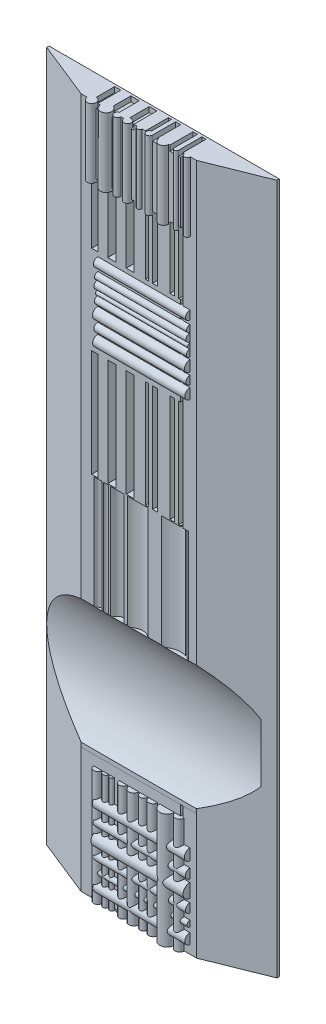
from build123d import *

# Parameters (mm, degrees)
SKETCH_1_W               = 10
SKETCH_1_H               = 30
EXTRUDE_1_DEPTH          = 0.1
EXTRUDE_3_DEPTH          = 30
SKETCH_5_W               = 0.454498822
SKETCH_5_H               = 30
SKETCH_5_W_2             = 0.583425646
SKETCH_5_W_3             = 0.53289148
SKETCH_5_W_4             = 0.499585763
SKETCH_5_W_5             = 0.432974328
SKETCH_5_W_6             = 0.188690598
EXTRUDE_4_DEPTH          = 1
SKETCH_6_W               = 0.173436604
SKETCH_6_H               = 29.993160216
EXTRUDE_5_DEPTH          = 1
SKETCH_8_W               = 3.86453934
SKETCH_8_H               = 5.343305872
SKETCH_8_H_2             = 5.042727614
SKETCH_8_H_3             = 3.852105428
SKETCH_8_H_4             = 2.649348074
EXTRUDE_6_DEPTH          = 1.1
SKETCH_9_R               = 0.240637295
SKETCH_9_R_2             = 0.202893243
SKETCH_9_R_3             = 0.297886253
SKETCH_9_R_4             = 0.192533604
SKETCH_9_R_5             = 0.130246979
SKETCH_9_R_6             = 0.222566816
SKETCH_9_R_7             = 0.191849261
SKETCH_9_R_8             = 0.146339903
SKETCH_9_R_9             = 0.170889957
SKETCH_9_R_10            = 0.154967887
SKETCH_9_R_11            = 0.099932002
SKETCH_9_R_12            = 0.234549929
SKETCH_9_R_13            = 0.176452329
SKETCH_9_R_14            = 0.225025609
EXTRUDE_7_DEPTH          = 4
SKETCH_10_R              = 0.177116069
EXTRUDE_10_DEPTH         = 5
SKETCH_10_R_2            = 0.129224803
EXTRUDE_10_2_DEPTH       = 5
SKETCH_10_R_3            = 0.10088007
EXTRUDE_10_3_DEPTH       = 5
SKETCH_10_R_4            = 0.176516126
EXTRUDE_10_4_DEPTH       = 5
SKETCH_10_R_5            = 0.21589061
EXTRUDE_10_5_DEPTH       = 5
SKETCH_10_R_6            = 0.174927125
EXTRUDE_10_6_DEPTH       = 5
SKETCH_10_R_7            = 0.193106243
EXTRUDE_10_7_DEPTH       = 5
SKETCH_10_R_8            = 0.316233655
EXTRUDE_10_8_DEPTH       = 5
SKETCH_10_R_9            = 0.197180527
EXTRUDE_10_9_DEPTH       = 5
SKETCH_11_R              = 0.196390845
SKETCH_11_R_2            = 0.245040541
SKETCH_11_R_3            = 0.145285858
SKETCH_11_R_4            = 0.158750232
SKETCH_11_R_5            = 0.105230331
SKETCH_11_R_6            = 0.136978563
SKETCH_11_R_7            = 0.21493991
SKETCH_11_R_8            = 0.094345299
SKETCH_11_R_9            = 0.130190265
EXTRUDE_11_DEPTH         = 3
SKETCH_12_R              = 0.177116069
SKETCH_12_R_2            = 0.102016514
SKETCH_12_R_3            = 0.289040351
SKETCH_12_R_4            = 0.571176078
SKETCH_12_R_5            = 0.818961001
CUT_EXTRUDE_1_DEPTH      = 5
SKETCH_13_W              = 4.974552889
SKETCH_13_H              = 1.100632881
EXTRUDE_12_DEPTH         = 5.5
CUT_EXTRUDE_2_DEPTH      = 9.5
CUT_EXTRUDE_2_DEPTH_BACK = 1
SKETCH_14_R              = 4.139688501


with BuildPart() as part:
    # 草图1 → 凸台-拉伸1 (new body)
    with BuildSketch(Plane.XY):
        with Locations((5, 15)):
            Rectangle(SKETCH_1_W, SKETCH_1_H)
    extrude(amount=EXTRUDE_1_DEPTH)

    # 草图4 → 凸台-拉伸3 (add)
    with BuildSketch(Plane.XZ):
        Polygon((0, 0.1), (2.499347574, 0.1), (2.499347574, 1.100632881), align=None)
        Polygon((10, 0.1), (7.500652426, 0.1), (7.500652426, 1.100632881), align=None)
    extrude(amount=-EXTRUDE_3_DEPTH)

    # 草图5 → 凸台-拉伸4 (add)
    with BuildSketch(Plane.XY.offset(0.1)):
        with Locations((2.726596985, 15)):
            Rectangle(SKETCH_5_W, SKETCH_5_H)
        with Locations((7.208939603, 15)):
            Rectangle(SKETCH_5_W_2, SKETCH_5_H)
        with Locations((6.084583842, 15)):
            Rectangle(SKETCH_5_W_3, SKETCH_5_H)
        with Locations((5.035453741, 15)):
            Rectangle(SKETCH_5_W_4, SKETCH_5_H)
        with Locations((4.23611652, 15)):
            Rectangle(SKETCH_5_W_5, SKETCH_5_H)
        with Locations((3.4367793, 15)):
            Rectangle(SKETCH_5_W_5, SKETCH_5_H)
        with Locations((6.639188729, 15)):
            Rectangle(SKETCH_5_W_6, SKETCH_5_H)
    extrude(amount=EXTRUDE_4_DEPTH)

    # 草图6 → 凸台-拉伸5 (add)
    with BuildSketch(Plane.XY.offset(0.1)):
        with Locations((5.509334574, 15.003419892)):
            Rectangle(SKETCH_6_W, SKETCH_6_H)
    extrude(amount=EXTRUDE_5_DEPTH)

    # 草图8 → 凸台-拉伸6 (add)
    with BuildSketch(Plane(origin=(0, 0, 0), x_dir=(-1, 0, 0), z_dir=(0, 0, -1))):
        with Locations((-4.885561619, 2.757954401)):
            Rectangle(SKETCH_8_W, SKETCH_8_H)
        with Locations((-4.885561619, 13.398711806)):
            Rectangle(SKETCH_8_W, SKETCH_8_H_2)
        with Locations((-4.885561619, 22.494886499)):
            Rectangle(SKETCH_8_W, SKETCH_8_H_3)
        with Locations((-4.885561619, 28.447189804)):
            Rectangle(SKETCH_8_W, SKETCH_8_H_4)
    extrude(amount=-EXTRUDE_6_DEPTH)

    # 草图9 → 凸台-拉伸7 (add)
    with BuildSketch(Plane.ZY.offset(-3.220292136)):
        with Locations(Location((1.1, 3.766258762, 0), (0, 0, 90))):
            Circle(SKETCH_9_R)
        with Locations(Location((1.1, 3.049121777, 0), (0, 0, 90))):
            Circle(SKETCH_9_R_2)
        with Locations(Location((1.100632881, 2.407472896, 0), (0, 0, 90.121729049))):
            Circle(SKETCH_9_R_3)
        with Locations(Location((1.1, 1.746951989, 0), (0, 0, 90))):
            Circle(SKETCH_9_R_4)
        with Locations(Location((1.100632881, 1.161919186, 0), (0, 0, 90.278405888))):
            Circle(SKETCH_9_R_5)
        with Locations(Location((1.1, 0.595758409, 0), (0, 0, 90))):
            Circle(SKETCH_9_R_6)
        with Locations(Location((1.1, 24.04455196, 0), (0, 0, 90))):
            Circle(SKETCH_9_R_7)
        with Locations(Location((1.1, 23.536528407, 0), (0, 0, 90))):
            Circle(SKETCH_9_R_8)
        with Locations(Location((1.1, 23.202079568, 0), (0, 0, 90))):
            Circle(SKETCH_9_R_9)
        with Locations(Location((1.1, 22.622086011, 0), (0, 0, 90))):
            Circle(SKETCH_9_R_10)
        with Locations(Location((1.1, 22.901498965, 0), (0, 0, 90))):
            Circle(SKETCH_9_R_11)
        with Locations(Location((1.1, 22.135230106, 0), (0, 0, 90))):
            Circle(SKETCH_9_R_12)
        with Locations(Location((1.1, 21.599849688, 0), (0, 0, 90))):
            Circle(SKETCH_9_R_13)
        with Locations(Location((1.100632881, 21.093882451, 0), (0, 0, 269.838856426))):
            Circle(SKETCH_9_R_14)
    extrude(amount=-EXTRUDE_7_DEPTH)

    # 草图11 → 凸台-拉伸11 (add)
    with BuildSketch(Plane(origin=(0, 30, 0), x_dir=(1, 0, 0), z_dir=(0, 1, 0))):
        with Locations((2.953846396, -1.1)):
            Circle(SKETCH_11_R)
        with Locations((3.580270181, -1.1)):
            Circle(SKETCH_11_R_2)
        with Locations((4.073349999, -1.1)):
            Circle(SKETCH_11_R_3)
        with Locations((4.515421559, -1.1)):
            Circle(SKETCH_11_R_4)
        with Locations((5.03545374, -1.1)):
            Circle(SKETCH_11_R_5)
        with Locations((5.459074313, -1.1)):
            Circle(SKETCH_11_R_6)
        with Locations((6.084583842, -1.1)):
            Circle(SKETCH_11_R_7)
        with Locations((6.639188729, -1.1)):
            Circle(SKETCH_11_R_8)
        with Locations((7.108341288, -1.1)):
            Circle(SKETCH_11_R_9)
    extrude(amount=-EXTRUDE_11_DEPTH)

    # 草图12 → 切除-拉伸1 (cut)
    with BuildSketch(Plane.XZ.offset(-10.877347999)):
        with Locations(Location((3.220292136, 1.1, 0), (0, 0, 270))):
            Circle(SKETCH_12_R)
        with Locations((3.571768805, 1.1)):
            Circle(SKETCH_12_R_2)
        with Locations((4.064848622, 1.1)):
            Circle(SKETCH_12_R_3)
        with Locations((4.948991743, 1.454905153)):
            Circle(SKETCH_12_R_4)
        with Locations((6.57275459, 1.675940933)):
            Circle(SKETCH_12_R_5)
    extrude(amount=-CUT_EXTRUDE_1_DEPTH, mode=Mode.SUBTRACT)

    # 草图13 → 凸台-拉伸12 (add)
    with BuildSketch(Plane(origin=(0, 5.429607337, 0), x_dir=(1, 0, 0), z_dir=(0, 1, 0))):
        with Locations((4.986624019, -0.550316441)):
            Rectangle(SKETCH_13_W, SKETCH_13_H)
    extrude(amount=EXTRUDE_12_DEPTH)

    # 草图14 → 切除-拉伸2 (cut, two sides: drawn at the far end of the back side and taken through both)
    with BuildSketch(Plane(origin=(0, 0, 0), x_dir=(0, 0, -1), z_dir=(1, 0, 0)).offset(-CUT_EXTRUDE_2_DEPTH_BACK)):
        with Locations((-4.239688501, 8.316418095)):
            Circle(SKETCH_14_R)
    extrude(amount=CUT_EXTRUDE_2_DEPTH + CUT_EXTRUDE_2_DEPTH_BACK, mode=Mode.SUBTRACT)


with BuildPart() as body_2:
    # 草图10 → 凸台-拉伸10 (new body)
    with BuildSketch(Plane.XZ):
        with Locations(Location((3.220292136, 1.1, 0), (0, 0, 270))):
            Circle(SKETCH_10_R)
    extrude(amount=-EXTRUDE_10_DEPTH)


with BuildPart() as body_3:
    # 草图10 → Extrude 10 2 (new body)
    with BuildSketch(Plane.XZ):
        with Locations(Location((3.571768805, 1.1, 0), (0, 0, 270))):
            Circle(SKETCH_10_R_2)
    extrude(amount=-EXTRUDE_10_2_DEPTH)


with BuildPart() as body_4:
    # 草图10 → Extrude 10 3 (new body)
    with BuildSketch(Plane.XZ):
        with Locations(Location((3.83644791, 1.1, 0), (0, 0, 270))):
            Circle(SKETCH_10_R_3)
    extrude(amount=-EXTRUDE_10_3_DEPTH)


with BuildPart() as body_5:
    # 草图10 → Extrude 10 4 (new body)
    with BuildSketch(Plane.XZ):
        with Locations(Location((4.328391283, 1.1, 0), (0, 0, 270))):
            Circle(SKETCH_10_R_4)
    extrude(amount=-EXTRUDE_10_4_DEPTH)


with BuildPart() as body_6:
    # 草图10 → Extrude 10 5 (new body)
    with BuildSketch(Plane.XZ):
        with Locations(Location((4.785660859, 1.1, 0), (0, 0, 270))):
            Circle(SKETCH_10_R_5)
    extrude(amount=-EXTRUDE_10_5_DEPTH)


with BuildPart() as body_7:
    # 草图10 → Extrude 10 6 (new body)
    with BuildSketch(Plane.XZ):
        with Locations(Location((5.23210962, 1.1, 0), (0, 0, 270))):
            Circle(SKETCH_10_R_6)
    extrude(amount=-EXTRUDE_10_6_DEPTH)


with BuildPart() as body_8:
    # 草图10 → Extrude 10 7 (new body)
    with BuildSketch(Plane.XZ):
        with Locations(Location((5.625848706, 1.1, 0), (0, 0, 270))):
            Circle(SKETCH_10_R_7)
    extrude(amount=-EXTRUDE_10_7_DEPTH)


with BuildPart() as body_9:
    # 草图10 → Extrude 10 8 (new body)
    with BuildSketch(Plane.XZ):
        with Locations(Location((6.228609776, 1.1, 0), (0, 0, 270))):
            Circle(SKETCH_10_R_8)
    extrude(amount=-EXTRUDE_10_8_DEPTH)


with BuildPart() as body_10:
    # 草图10 → Extrude 10 9 (new body)
    with BuildSketch(Plane.XZ):
        with Locations(Location((6.775682658, 1.1, 0), (0, 0, 270))):
            Circle(SKETCH_10_R_9)
    extrude(amount=-EXTRUDE_10_9_DEPTH)


solid = Compound([part.part, body_2.part, body_3.part, body_4.part, body_5.part, body_6.part, body_7.part, body_8.part, body_9.part, body_10.part])
